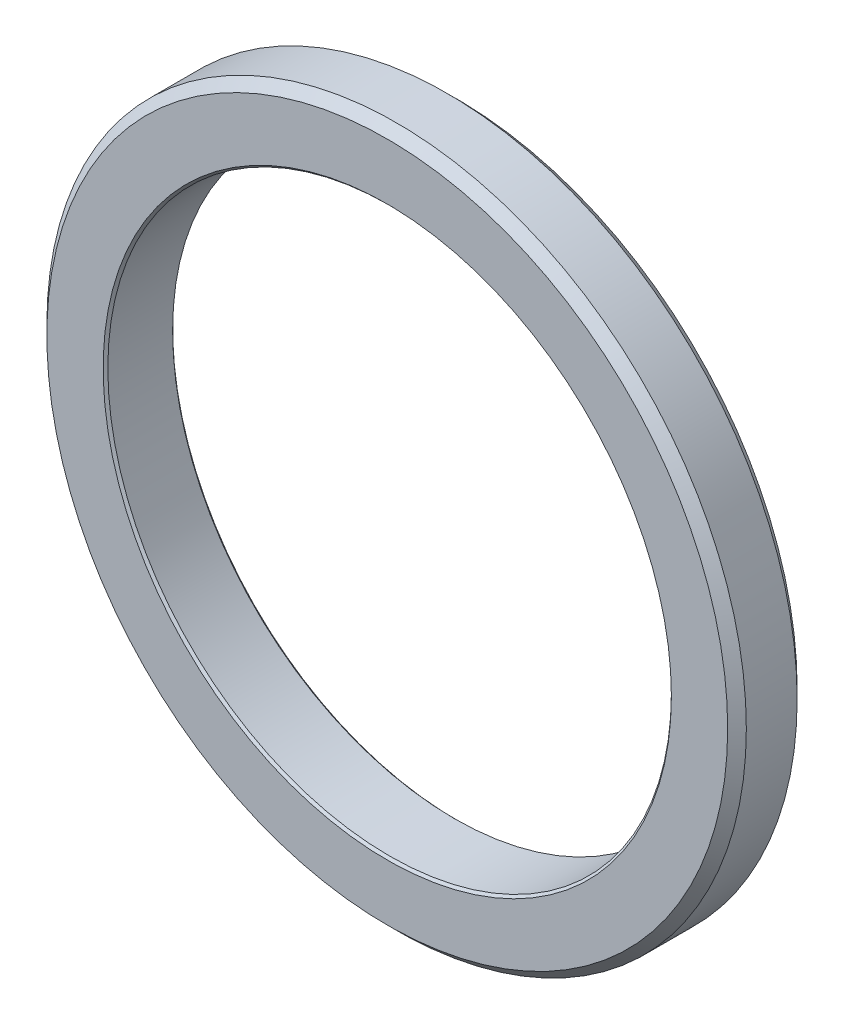
from build123d import *


with BuildPart() as part:
    # Sketch1 → Revolve1 (revolve)
    with BuildSketch(Plane(origin=(0, 0, 0), x_dir=(0, 0, -1), z_dir=(1, 0, 0)), mode=Mode.PRIVATE) as revolve1_sk:
        Polygon((0, 30.475), (0.25, 30.225), (7.2, 30.225), (7.45, 30.475), (7.45, 36.515), (6.45, 37.515), (1, 37.515), (0, 36.515), align=None)
    revolve(revolve1_sk.sketch.rotate(Axis((0, 0, 0), (0, 0, -1)), 90), axis=Axis((0, 0, 0), (0, 0, -1)))


solid = part.part
